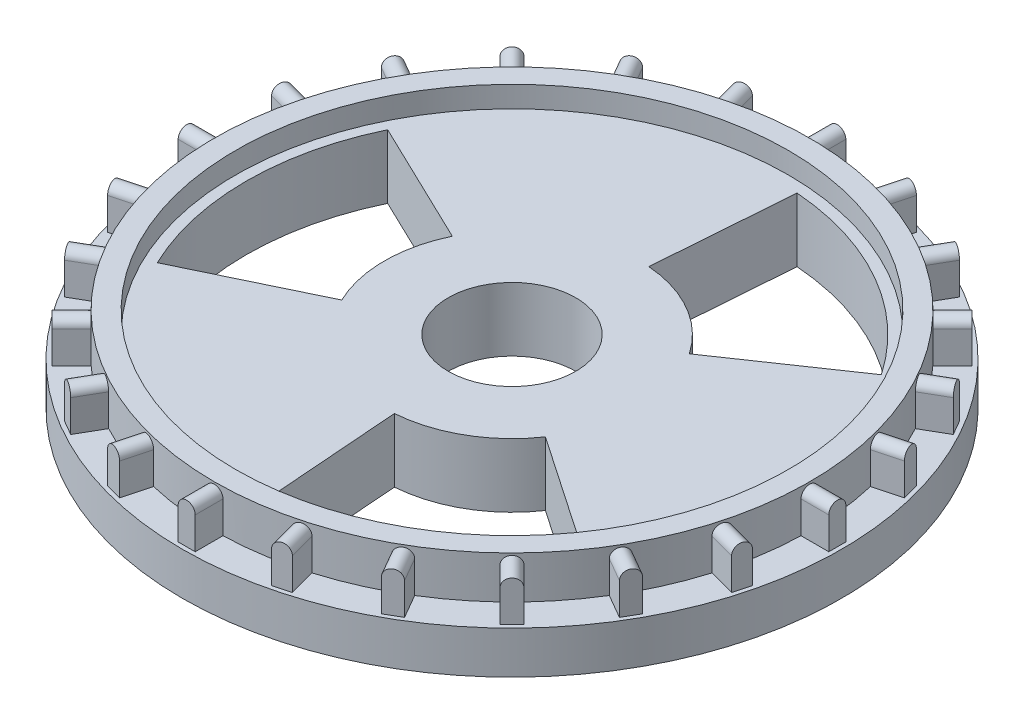
from build123d import *

# Parameters (mm, degrees)
SKETCH1_R                = 196.85
BOSS_EXTRUDE1_DEPTH      = 25.4
SKETCH2_R                = 177.8
BOSS_EXTRUDE2_DEPTH      = 25.4
SKETCH3_R                = 165.1
CUT_EXTRUDE1_DEPTH       = 12.7
BOSS_EXTRUDE5_REACH      = 442.836
BOSS_EXTRUDE5_END_RADIUS = 177.8
CIRPATTERN2_COUNT        = 24
SKETCH7_R                = 38.1
CUT_EXTRUDE2_DEPTH       = 281.983015501
CUT_EXTRUDE3_DEPTH       = 281.983015501
CIRPATTERN3_COUNT        = 3


with BuildPart() as part:
    # Sketch1 → Boss-Extrude1 (new body)
    with BuildSketch(Plane(origin=(0, 0, 0), x_dir=(1, 0, 0), z_dir=(0, 1, 0))):
        with Locations(Location((0, 0, 0), (0, 0, 270))):
            Circle(SKETCH1_R)
    extrude(amount=BOSS_EXTRUDE1_DEPTH)

    # Sketch2 → Boss-Extrude2 (add)
    with BuildSketch(Plane(origin=(0, 25.4, 0), x_dir=(1, 0, 0), z_dir=(0, 1, 0))):
        with Locations(Location((0, 0, 0), (0, 0, 270))):
            Circle(SKETCH2_R)
    extrude(amount=BOSS_EXTRUDE2_DEPTH)

    # Sketch3 → Cut-Extrude1 (cut)
    with BuildSketch(Plane(origin=(0, 50.8, 0), x_dir=(1, 0, 0), z_dir=(0, 1, 0))):
        with Locations(Location((0, 0, 0), (0, 0, 270))):
            Circle(SKETCH3_R)
    extrude(amount=-CUT_EXTRUDE1_DEPTH, mode=Mode.SUBTRACT)

    # Boss-Extrude5: up to this cylinder (the profile starts outside it)
    boss_extrude5_end = Plane(origin=(0, 36.94781, 0), z_dir=(0, -1, 0)) * Cylinder(BOSS_EXTRUDE5_END_RADIUS, 1242.272, mode=Mode.PRIVATE)
    # Sketch6 → Boss-Extrude5 (add, up to the surface)
    with BuildSketch(Plane(origin=(194.31, 0, 0), x_dir=(0, 0, -1), z_dir=(1, 0, 0)), mode=Mode.PRIVATE) as boss_extrude5_sk1:
        with BuildLine():
            Line((-5.08, 44.45), (-5.08, 25.4))
            Line((-5.08, 25.4), (5.08, 25.4))
            Line((5.08, 25.4), (5.08, 44.45))
            ThreePointArc((5.08, 44.45), (0, 49.53), (-5.08, 44.45))
        make_face()
    boss_extrude5_tool1 = extrude(boss_extrude5_sk1.sketch, amount=-BOSS_EXTRUDE5_REACH, mode=Mode.PRIVATE) - boss_extrude5_end
    boss_extrude5 = boss_extrude5_tool1.solids().sort_by_distance((194.31, 36.94781, 0))[0]
    add(boss_extrude5)

    # CirPattern2: Boss-Extrude5 ×24 about axis
    cirpattern2_axis = Axis((0, 0, 0), (0, 1, 0))
    for i in range(1, CIRPATTERN2_COUNT):
        add(boss_extrude5.rotate(cirpattern2_axis, i * 360 / CIRPATTERN2_COUNT))

    # Sketch7 → Cut-Extrude2 (cut, through all)
    with BuildSketch(Plane(origin=(0, 38.1, 0), x_dir=(1, 0, 0), z_dir=(0, 1, 0))):
        with Locations(Location((0, 0, 0), (0, 0, 270))):
            Circle(SKETCH7_R)
    extrude(amount=-CUT_EXTRUDE2_DEPTH, mode=Mode.SUBTRACT)

    # Sketch8 → Cut-Extrude3 (cut, through all)
    with BuildSketch(Plane(origin=(0, 38.1, 0), x_dir=(1, 0, 0), z_dir=(0, 1, 0))):
        with BuildLine():
            Line((-68.67400964, 33.02), (-143.070853416, 68.791666667))
            ThreePointArc((-143.070853416, 68.791666667), (-158.75, 0), (-143.070853416, -68.791666667))
            Line((-143.070853416, -68.791666667), (-68.67400964, -33.02))
            ThreePointArc((-68.67400964, -33.02), (-76.2, 0), (-68.67400964, 33.02))
        make_face()
    cut_extrude3 = extrude(amount=-CUT_EXTRUDE3_DEPTH, mode=Mode.SUBTRACT)

    # CirPattern3: Cut-Extrude3 ×3 about axis
    cirpattern3_axis = Axis((0, 0, 0), (0, 1, 0))
    for i in range(1, CIRPATTERN3_COUNT):
        add(cut_extrude3.rotate(cirpattern3_axis, i * 360 / CIRPATTERN3_COUNT), mode=Mode.SUBTRACT)


solid = part.part
